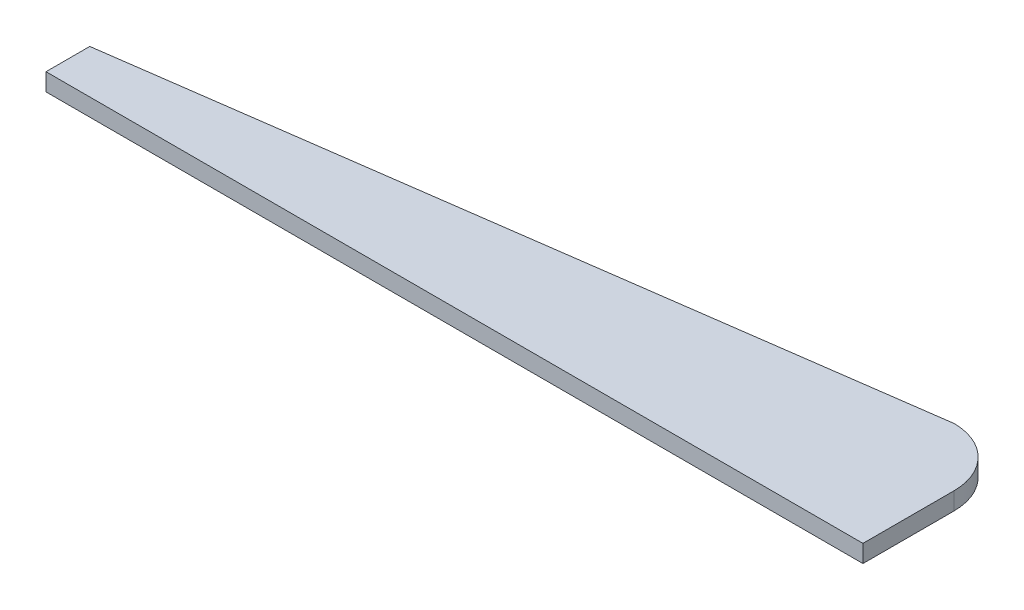
from build123d import *

# Parameters (mm, degrees)
BOSS_EXTRUDE1_DEPTH = 6


with BuildPart() as part:
    # Sketch1 → Boss-Extrude1 (new body)
    with BuildSketch(Plane(origin=(0, 0, 0), x_dir=(1, 0, 0), z_dir=(0, 1, 0))):
        with BuildLine():
            Line((39.037500682, -3.356727766), (39.037500682, 27.843272234))
            ThreePointArc((39.037500682, 27.843272234), (33.179636306, 41.985407858), (19.037500682, 47.843272234))
            Line((19.037500682, 47.843272234), (-240.962499318, 11.643272234))
            Line((-240.962499318, 11.643272234), (-240.962499318, -3.356727766))
            Line((-240.962499318, -3.356727766), (39.037500682, -3.356727766))
        make_face()
    extrude(amount=BOSS_EXTRUDE1_DEPTH)


solid = part.part
